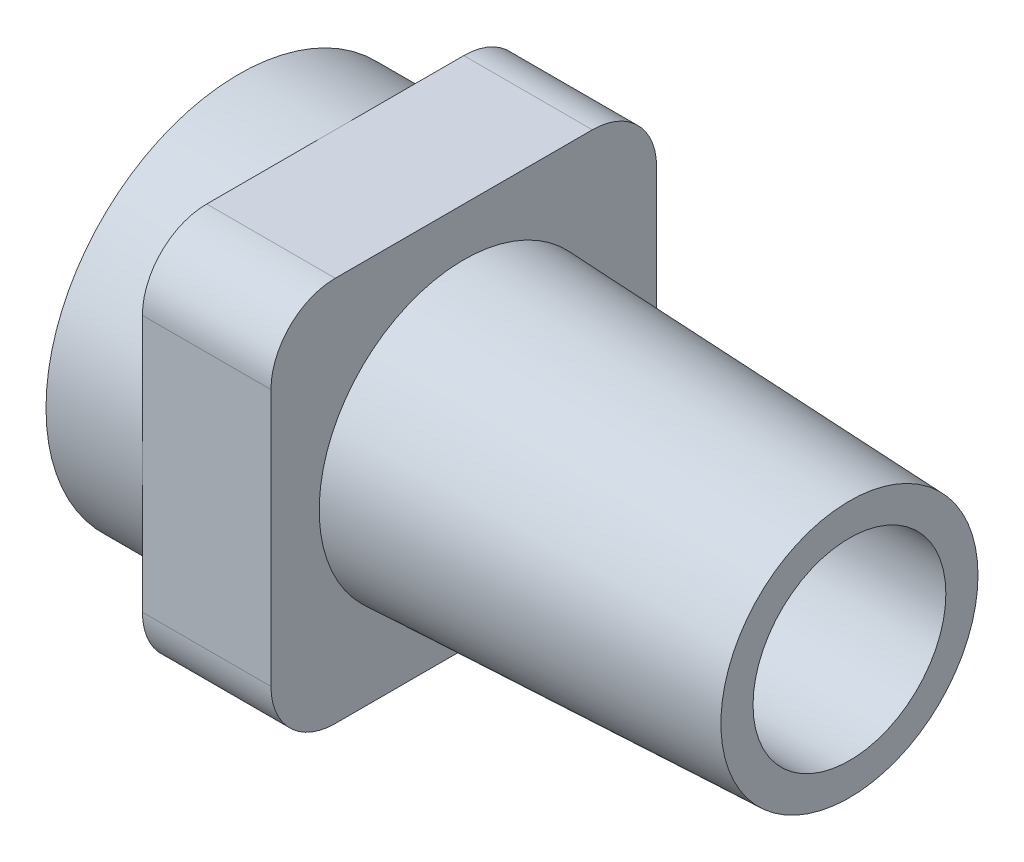
from build123d import *

# Parameters (mm, degrees)
BASES_W                     = 6
BASES_H                     = 6
BASE_DEPTH                  = 1
INSIDEWIREHOLDINGBODYS_R    = 3
INSIDEWIREHOLDINGBODY_DEPTH = 1.5
FRONTFACES_R                = 2.25
REARFACES_R                 = 2
HOLE_DEPTH                  = 9.185352857
HOLE_DEPTH_BACK             = 9.185352857
HOLES_R                     = 1.5
BASEFILLET_R                = 1


with BuildPart() as part:
    # BaseS → Base (new, symmetric)
    with BuildSketch(Plane(origin=(0, 0, 0), x_dir=(0, 0, -1), z_dir=(1, 0, 0))):
        Rectangle(BASES_W, BASES_H)
    extrude(amount=BASE_DEPTH, both=True)

    # InsideWireHoldingBodyS → InsideWireHoldingBody (add)
    with BuildSketch(Plane.ZY.offset(1)):
        Circle(INSIDEWIREHOLDINGBODYS_R)
    extrude(amount=INSIDEWIREHOLDINGBODY_DEPTH)

    # FrontFaceS → StrainReliefBody section 0
    with BuildSketch(Plane(origin=(1, 0, 0), x_dir=(0, 0, -1), z_dir=(1, 0, 0))):
        Circle(FRONTFACES_R)
    # RearFaceS → StrainReliefBody section 1
    with BuildSketch(Plane(origin=(7, 0, 0), x_dir=(0, 0, -1), z_dir=(1, 0, 0))):
        Circle(REARFACES_R)
    loft()

    # HoleS → Hole (cut, two sides: drawn at the far end of the back side and taken through both)
    with BuildSketch(Plane(origin=(0, 0, 0), x_dir=(0, 0, -1), z_dir=(1, 0, 0)).offset(-HOLE_DEPTH_BACK)):
        Circle(HOLES_R)
    extrude(amount=HOLE_DEPTH + HOLE_DEPTH_BACK, mode=Mode.SUBTRACT)

    # BaseFillet
    basefillet_edges = [part.edges().sort_by_distance(p)[0] for p in [
        (0, -3, -3),
        (0, -3, 3),
        (0, 3, 3),
        (0, 3, -3),
    ]]
    fillet(basefillet_edges, radius=BASEFILLET_R)


solid = part.part
